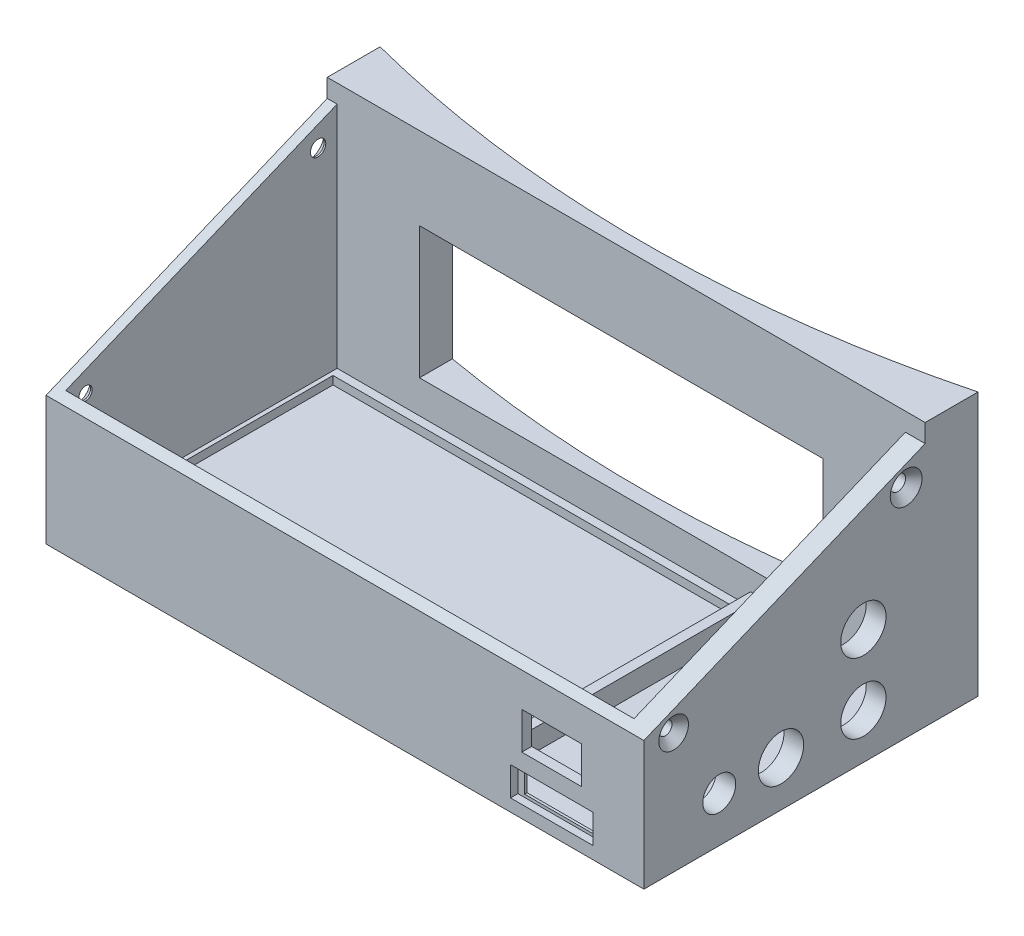
from build123d import *

# Parameters (mm, degrees)
SKIZZE1_W                         = 145.2
SKIZZE1_H                         = 70.7
AUFSATZ_LINEAR_AUSTRAGEN1_DEPTH   = 64
AUFSATZ_LINEAR_AUSTRAGEN2_DEPTH   = 64
SKIZZE4_W                         = 100.4
SKIZZE4_H                         = 65.9
SKIZZE4_W_2                       = 35.2
SCHNITT_LINEAR_AUSTRAGEN3_DEPTH   = 179.21855852
SKIZZE5_W                         = 100.4
SKIZZE5_H                         = 65.9
AUFSATZ_LINEAR_AUSTRAGEN3_DEPTH   = 2
SKIZZE5_W_2                       = 35.2
AUFSATZ_LINEAR_AUSTRAGEN3_2_DEPTH = 2
SKIZZE6_W                         = 100.4
SKIZZE6_H                         = 65.9
SKIZZE6_W_2                       = 98.4
SKIZZE6_H_2                       = 61.9
AUFSATZ_LINEAR_AUSTRAGEN4_DEPTH   = 2
SKIZZE8_W                         = 2.4
SKIZZE8_H                         = 65.9
SCHNITT_LINEAR_AUSTRAGEN4_DEPTH   = 56.8
SCHNITT_LINEAR_AUSTRAGEN5_DEPTH   = 179.21855852
SCHNITT_LINEAR_AUSTRAGEN6_DEPTH   = 179.21855852
SKIZZE11_W                        = 98
SKIZZE11_H                        = 32
SCHNITT_LINEAR_AUSTRAGEN7_DEPTH   = 173.753957986
SKIZZE12_R                        = 1.862936884
SKIZZE12_R_2                      = 1.6
SCHNITT_LINEAR_AUSTRAGEN8_DEPTH   = 179.21855852
FASE1_SIZE                        = 2
SKIZZE13_R                        = 5.5
SKIZZE13_R_2                      = 4
SCHNITT_LINEAR_AUSTRAGEN9_DEPTH   = 4.8
SKIZZE14_W                        = 20
SKIZZE14_H                        = 7
SCHNITT_LINEAR_AUSTRAGEN10_DEPTH  = 1.8
SKIZZE15_W                        = 16.8
SKIZZE15_H                        = 5.3
SCHNITT_LINEAR_AUSTRAGEN11_DEPTH  = 0.6
SKIZZE16_W                        = 14.5
SKIZZE16_H                        = 9
SCHNITT_LINEAR_AUSTRAGEN12_DEPTH  = 2.4


with BuildPart() as part:
    # Skizze1 → Aufsatz-Linear austragen1 (new body)
    with BuildSketch(Plane(origin=(0, 0, 0), x_dir=(1, 0, 0), z_dir=(0, 1, 0))):
        with Locations((72.6, 35.35)):
            Rectangle(SKIZZE1_W, SKIZZE1_H)
    extrude(amount=AUFSATZ_LINEAR_AUSTRAGEN1_DEPTH)

    # Skizze3 → Aufsatz-Linear austragen2 (add)
    with BuildSketch(Plane.XZ):
        with BuildLine():
            Line((0, -70.7), (145.2, -70.7))
            Line((145.2, -70.7), (145.2, -81.134546285))
            ThreePointArc((145.2, -81.134546285), (72.6, -71.9), (0, -81.134546285))
            Line((0, -81.134546285), (0, -70.7))
        make_face()
    extrude(amount=-AUFSATZ_LINEAR_AUSTRAGEN2_DEPTH)

    # Skizze4 → Schnitt-Linear austragen3 (cut, through all)
    with BuildSketch(Plane.XZ):
        with Locations((52.6, -35.35)):
            Rectangle(SKIZZE4_W, SKIZZE4_H)
        with Locations((122.8, -35.35)):
            Rectangle(SKIZZE4_W_2, SKIZZE4_H)
    extrude(amount=-SCHNITT_LINEAR_AUSTRAGEN3_DEPTH, mode=Mode.SUBTRACT)



with BuildPart() as body_2:
    # Skizze5 → Aufsatz-Linear austragen3 (new body)
    with BuildSketch(Plane.XZ):
        with Locations((52.6, -35.35)):
            Rectangle(SKIZZE5_W, SKIZZE5_H)
    extrude(amount=-AUFSATZ_LINEAR_AUSTRAGEN3_DEPTH)


with BuildPart() as body_3:
    # Skizze5 → Aufsatz-Linear austragen3 2 (new body)
    with BuildSketch(Plane.XZ):
        with Locations((122.8, -35.35)):
            Rectangle(SKIZZE5_W_2, SKIZZE5_H)
    extrude(amount=-AUFSATZ_LINEAR_AUSTRAGEN3_2_DEPTH)


with BuildPart() as part_1:
    add(part.part)

    add(body_2.part)  # Aufsatz-Linear austragen4 merges body 2
    # Skizze6 → Aufsatz-Linear austragen4 (add)
    with BuildSketch(Plane(origin=(0, 2, 0), x_dir=(1, 0, 0), z_dir=(0, 1, 0))):
        with Locations((52.6, 35.35)):
            Rectangle(SKIZZE6_W, SKIZZE6_H)
        with Locations((52.6, 35.35)):
            Rectangle(SKIZZE6_W_2, SKIZZE6_H_2, mode=Mode.SUBTRACT)
    extrude(amount=AUFSATZ_LINEAR_AUSTRAGEN4_DEPTH)

    # Skizze8 → Schnitt-Linear austragen4 (cut)
    with BuildSketch(Plane(origin=(0, 64, 0), x_dir=(1, 0, 0), z_dir=(0, 1, 0))):
        with Locations((104, 35.35)):
            Rectangle(SKIZZE8_W, SKIZZE8_H)
    extrude(amount=-SCHNITT_LINEAR_AUSTRAGEN4_DEPTH, mode=Mode.SUBTRACT)

    # Skizze9 → Schnitt-Linear austragen5 (cut, through all)
    with BuildSketch(Plane.ZY):
        Polygon((-68.3, 64), (0, 64), (0, 35.70921369), align=None)
    extrude(amount=-SCHNITT_LINEAR_AUSTRAGEN5_DEPTH, mode=Mode.SUBTRACT)

    # Skizze10 → Schnitt-Linear austragen6 (cut, through all)
    with BuildSketch(Plane.ZY):
        Polygon((-68.3, 64), (0, 35.70921369), (0, 31.271405669), (-68.3, 59.562191979), align=None)
    extrude(amount=-SCHNITT_LINEAR_AUSTRAGEN6_DEPTH, mode=Mode.SUBTRACT)

    # Skizze11 → Schnitt-Linear austragen7 (cut, through all)
    with BuildSketch(Plane.XY.offset(-68.3)):
        with Locations((71.4, 28)):
            Rectangle(SKIZZE11_W, SKIZZE11_H)
    extrude(amount=-SCHNITT_LINEAR_AUSTRAGEN7_DEPTH, mode=Mode.SUBTRACT)

    # Skizze12 → Schnitt-Linear austragen8 (cut, through all)
    with BuildSketch(Plane.ZY):
        with Locations((-63.680602337, 52.648774817)):
            Circle(SKIZZE12_R)
        with Locations((-7.219397663, 29.261778093)):
            Circle(SKIZZE12_R_2)
    extrude(amount=-SCHNITT_LINEAR_AUSTRAGEN8_DEPTH, mode=Mode.SUBTRACT)

    # Fase1
    fase1_edges = [part_1.edges().sort_by_distance(p)[0] for p in [
        (145.2, 52.648774817, -65.543539222),
        (0, 52.648774817, -65.543539222),
        (145.2, 29.261778093, -8.819397663),
        (0, 29.261778093, -8.819397663),
    ]]
    chamfer(fase1_edges, length=FASE1_SIZE)

    # Skizze13 → Schnitt-Linear austragen9 (cut)
    with BuildSketch(Plane(origin=(145.2, 0, 0), x_dir=(0, 0, -1), z_dir=(1, 0, 0))):
        with Locations((53.3, 11)):
            Circle(SKIZZE13_R)
        with Locations((53.3, 28)):
            Circle(SKIZZE13_R)
        with Locations((33.3, 11)):
            Circle(SKIZZE13_R)
        with Locations((18.3, 11)):
            Circle(SKIZZE13_R_2)
    extrude(amount=-SCHNITT_LINEAR_AUSTRAGEN9_DEPTH, mode=Mode.SUBTRACT)

    # Skizze14 → Schnitt-Linear austragen10 (cut)
    with BuildSketch(Plane.XY):
        with Locations((122.8, 6.5)):
            Rectangle(SKIZZE14_W, SKIZZE14_H)
    extrude(amount=-SCHNITT_LINEAR_AUSTRAGEN10_DEPTH, mode=Mode.SUBTRACT)

    # Skizze15 → Schnitt-Linear austragen11 (cut)
    with BuildSketch(Plane.XY.offset(-1.8)):
        with Locations((122.8, 6.35)):
            Rectangle(SKIZZE15_W, SKIZZE15_H)
    extrude(amount=-SCHNITT_LINEAR_AUSTRAGEN11_DEPTH, mode=Mode.SUBTRACT)

    # Skizze16 → Schnitt-Linear austragen12 (cut)
    with BuildSketch(Plane.XY):
        with Locations((122.8, 18.5)):
            Rectangle(SKIZZE16_W, SKIZZE16_H)
    extrude(amount=-SCHNITT_LINEAR_AUSTRAGEN12_DEPTH, mode=Mode.SUBTRACT)


solid = Compound([body_3.part, part_1.part])
